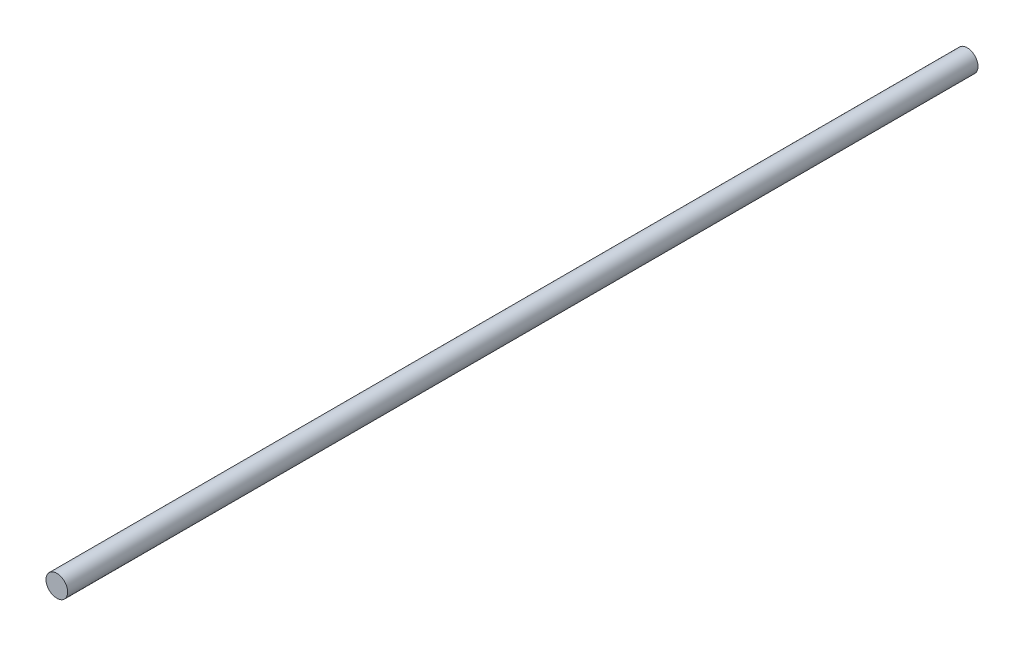
from build123d import *

# Parameters (mm, degrees)
SKETCH_1_R      = 4
EXTRUDE_1_DEPTH = 336


with BuildPart() as part:
    # 草图1 → 凸台-拉伸1 (new body)
    with BuildSketch(Plane.XY):
        with Locations(Location((0, 0, 0), (0, 0, 180))):
            Circle(SKETCH_1_R)
    extrude(amount=EXTRUDE_1_DEPTH)


solid = part.part
